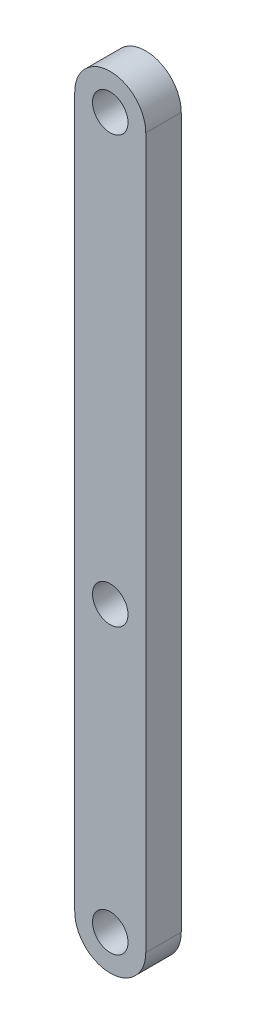
from build123d import *

# Parameters (mm, degrees)
SKETCH1_R           = 1
BOSS_EXTRUDE1_DEPTH = 2


with BuildPart() as part:
    # Sketch1 → Boss-Extrude1 (new body)
    with BuildSketch(Plane.XY):
        with BuildLine():
            Line((2, 0), (2, -40))
            ThreePointArc((2, -40), (0, -42), (-2, -40))
            Line((-2, -40), (-2, 0))
            ThreePointArc((-2, 0), (0, 2), (2, 0))
        make_face()
        Circle(SKETCH1_R, mode=Mode.SUBTRACT)
        with Locations((0, -40)):
            Circle(SKETCH1_R, mode=Mode.SUBTRACT)
        with Locations((0, -24)):
            Circle(SKETCH1_R, mode=Mode.SUBTRACT)
    extrude(amount=BOSS_EXTRUDE1_DEPTH)


solid = part.part
